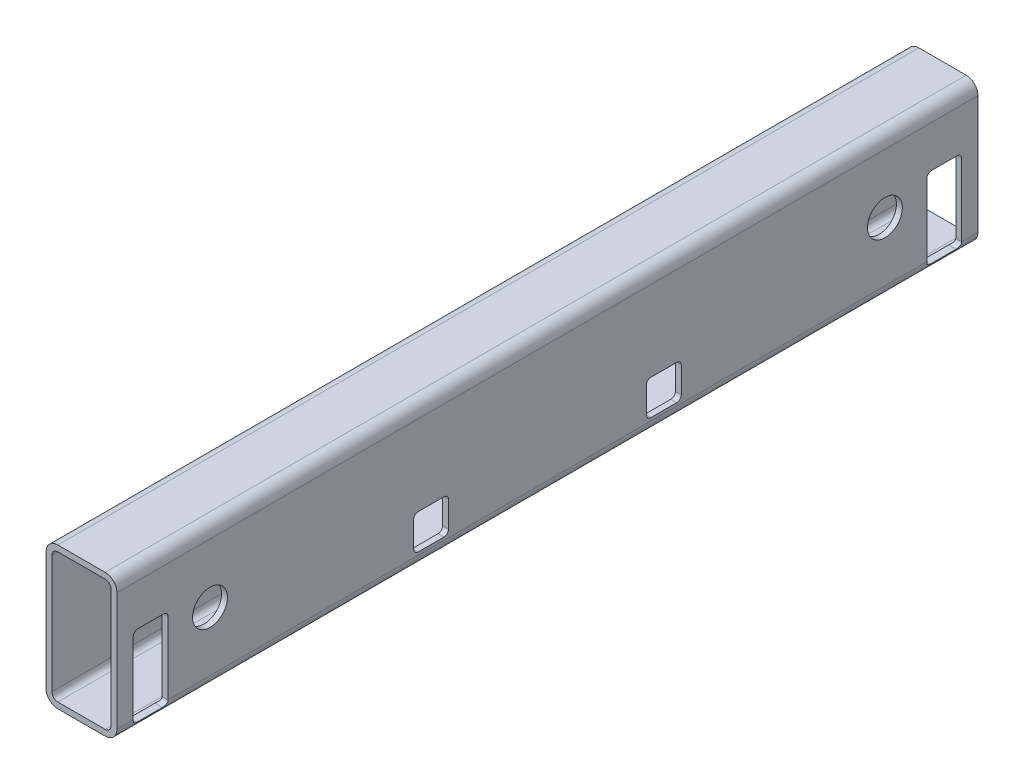
from build123d import *

# Parameters (mm, degrees)
BOSS_EXTRUDE1_DEPTH                       = 925
CUT_EXTRUDE1_DEPTH                        = 30
FOR_MACH_SHOP_CONFIRM_W_PROGRAMMING_REACH = 951.777
SKETCH5_R                                 = 37.5
CUT_EXTRUDE3_DEPTH                        = 950.777089767


with BuildPart() as part:
    # Sketch1 → Boss-Extrude1 (new, symmetric)
    with BuildSketch(Plane.XY):
        with BuildLine():
            Line((-50.8, -152.4), (50.8, -152.4))
            ThreePointArc((50.8, -152.4), (68.760512242, -144.960512242), (76.2, -127))
            Line((76.2, -127), (76.2, 127))
            ThreePointArc((76.2, 127), (68.760512242, 144.960512242), (50.8, 152.4))
            Line((50.8, 152.4), (-50.8, 152.4))
            ThreePointArc((-50.8, 152.4), (-68.760512242, 144.960512242), (-76.2, 127))
            Line((-76.2, 127), (-76.2, -127))
            ThreePointArc((-76.2, -127), (-68.760512242, -144.960512242), (-50.8, -152.4))
        make_face()
        with BuildLine():
            Line((-50.8, -139.7), (50.8, -139.7))
            ThreePointArc((50.8, -139.7), (59.780256121, -135.980256121), (63.5, -127))
            Line((63.5, -127), (63.5, 127))
            ThreePointArc((63.5, 127), (59.780256121, 135.980256121), (50.8, 139.7))
            Line((50.8, 139.7), (-50.8, 139.7))
            ThreePointArc((-50.8, 139.7), (-59.780256121, 135.980256121), (-63.5, 127))
            Line((-63.5, 127), (-63.5, -127))
            ThreePointArc((-63.5, -127), (-59.780256121, -135.980256121), (-50.8, -139.7))
        make_face(mode=Mode.SUBTRACT)
    extrude(amount=BOSS_EXTRUDE1_DEPTH, both=True)

    # Sketch2 → Cut-Extrude1 (cut)
    with BuildSketch(Plane(origin=(76.2, 0, 0), x_dir=(0, 0, -1), z_dir=(1, 0, 0))):
        with BuildLine():
            Line((-880, 37.6), (-825, 37.6))
            ThreePointArc((-825, 37.6), (-817.928932188, 34.671067812), (-815, 27.6))
            Line((-815, 27.6), (-815, -127.4))
            ThreePointArc((-815, -127.4), (-817.928932188, -134.471067812), (-825, -137.4))
            Line((-825, -137.4), (-880, -137.4))
            ThreePointArc((-880, -137.4), (-887.071067812, -134.471067812), (-890, -127.4))
            Line((-890, -127.4), (-890, 27.6))
            ThreePointArc((-890, 27.6), (-887.071067812, 34.671067812), (-880, 37.6))
        make_face()
        with BuildLine():
            Line((825, 37.6), (880, 37.6))
            ThreePointArc((880, 37.6), (887.071067812, 34.671067812), (890, 27.6))
            Line((890, 27.6), (890, -127.4))
            ThreePointArc((890, -127.4), (887.071067812, -134.471067812), (880, -137.4))
            Line((880, -137.4), (825, -137.4))
            ThreePointArc((825, -137.4), (817.928932188, -134.471067812), (815, -127.4))
            Line((815, -127.4), (815, 27.6))
            ThreePointArc((815, 27.6), (817.928932188, 34.671067812), (825, 37.6))
        make_face()
    extrude(amount=-CUT_EXTRUDE1_DEPTH, mode=Mode.SUBTRACT)

    # Sketch3 → for mach shop confirm w/ programming (cut, up to next)
    with BuildSketch(Plane(origin=(76.2, 0, 0), x_dir=(0, 0, -1), z_dir=(1, 0, 0)), mode=Mode.PRIVATE) as for_mach_shop_confirm_w_programming_sk1:
        with BuildLine():
            Line((-277.5, -45.65), (-222.5, -45.65))
            ThreePointArc((-222.5, -45.65), (-215.428932188, -48.578932188), (-212.5, -55.65))
            Line((-212.5, -55.65), (-212.5, -110.65))
            ThreePointArc((-212.5, -110.65), (-215.428932188, -117.721067812), (-222.5, -120.65))
            Line((-222.5, -120.65), (-277.5, -120.65))
            ThreePointArc((-277.5, -120.65), (-284.571067812, -117.721067812), (-287.5, -110.65))
            Line((-287.5, -110.65), (-287.5, -55.65))
            ThreePointArc((-287.5, -55.65), (-284.571067812, -48.578932188), (-277.5, -45.65))
        make_face()
    for_mach_shop_confirm_w_programming_tool1 = extrude(for_mach_shop_confirm_w_programming_sk1.sketch, amount=-FOR_MACH_SHOP_CONFIRM_W_PROGRAMMING_REACH, mode=Mode.PRIVATE) & part.part
    # Sketch3 → for mach shop confirm w/ programming (cut, up to next)
    with BuildSketch(Plane(origin=(76.2, 0, 0), x_dir=(0, 0, -1), z_dir=(1, 0, 0)), mode=Mode.PRIVATE) as for_mach_shop_confirm_w_programming_sk2:
        with BuildLine():
            Line((222.5, -45.65), (277.5, -45.65))
            ThreePointArc((277.5, -45.65), (284.571067812, -48.578932188), (287.5, -55.65))
            Line((287.5, -55.65), (287.5, -110.65))
            ThreePointArc((287.5, -110.65), (284.571067812, -117.721067812), (277.5, -120.65))
            Line((277.5, -120.65), (222.5, -120.65))
            ThreePointArc((222.5, -120.65), (215.428932188, -117.721067812), (212.5, -110.65))
            Line((212.5, -110.65), (212.5, -55.65))
            ThreePointArc((212.5, -55.65), (215.428932188, -48.578932188), (222.5, -45.65))
        make_face()
    for_mach_shop_confirm_w_programming_tool2 = extrude(for_mach_shop_confirm_w_programming_sk2.sketch, amount=-FOR_MACH_SHOP_CONFIRM_W_PROGRAMMING_REACH, mode=Mode.PRIVATE) & part.part
    add(for_mach_shop_confirm_w_programming_tool1.solids().sort_by_distance((76.2, -83.15, 250))[0], mode=Mode.SUBTRACT)
    add(for_mach_shop_confirm_w_programming_tool2.solids().sort_by_distance((76.2, -83.15, -250))[0], mode=Mode.SUBTRACT)

    # Sketch5 → Cut-Extrude3 (cut, through all)
    with BuildSketch(Plane.ZY.offset(76.2)):
        with Locations((725, 0)):
            Circle(SKETCH5_R)
        with Locations((-725, 0)):
            Circle(SKETCH5_R)
    extrude(amount=-CUT_EXTRUDE3_DEPTH, mode=Mode.SUBTRACT)


solid = part.part
